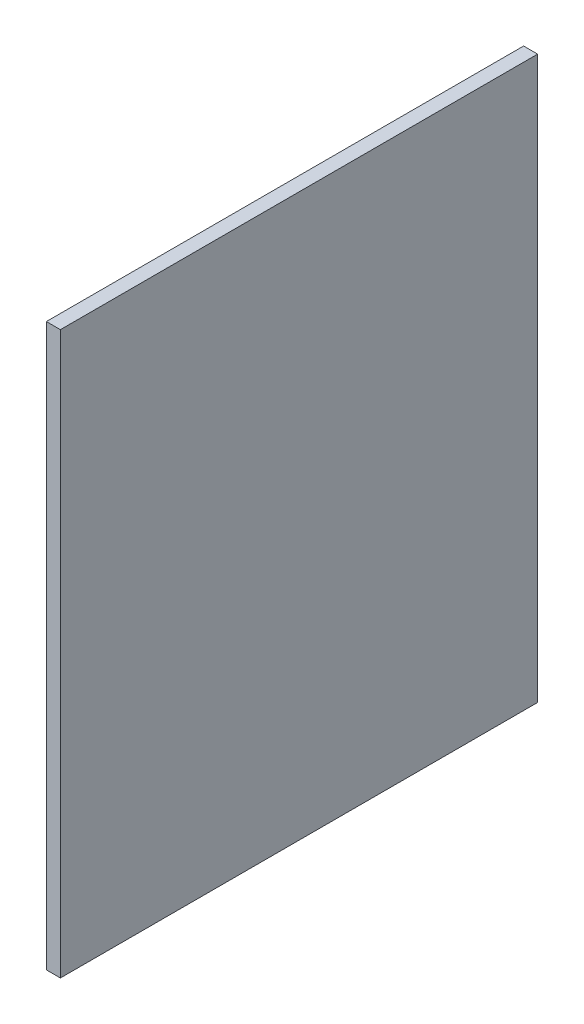
from build123d import *

# Parameters (mm, degrees)
CROQUIS1_W              = 170
CROQUIS1_H              = 200
SALIENTE_EXTRUIR1_DEPTH = 5


with BuildPart() as part:
    # Croquis1 → Saliente-Extruir1 (new body)
    with BuildSketch(Plane(origin=(0, 0, 0), x_dir=(0, 0, -1), z_dir=(1, 0, 0))):
        Rectangle(CROQUIS1_W, CROQUIS1_H)
    extrude(amount=SALIENTE_EXTRUIR1_DEPTH)


solid = part.part
